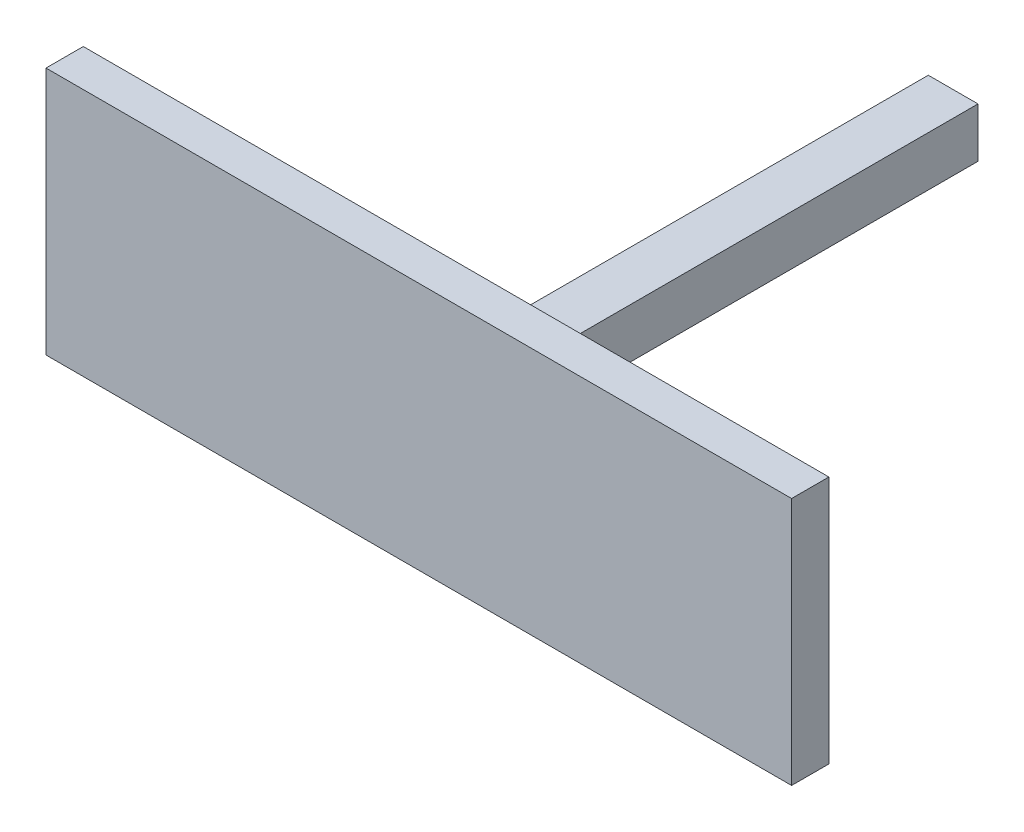
from build123d import *

# Parameters (mm, degrees)
ESQUISSE1_W        = 60
ESQUISSE1_H        = 20
BOSS_EXTRU_1_DEPTH = 3
ESQUISSE2_W        = 4
ESQUISSE2_H        = 4
BOSS_EXTRU_2_DEPTH = 40


with BuildPart() as part:
    # Esquisse1 → Boss.-Extru.1 (new body)
    with BuildSketch(Plane.XY):
        Rectangle(ESQUISSE1_W, ESQUISSE1_H)
    extrude(amount=BOSS_EXTRU_1_DEPTH)

    # Esquisse2 → Boss.-Extru.2 (add)
    with BuildSketch(Plane(origin=(0, 0, 0), x_dir=(-1, 0, 0), z_dir=(0, 0, -1))):
        Rectangle(ESQUISSE2_W, ESQUISSE2_H)
    extrude(amount=BOSS_EXTRU_2_DEPTH)


solid = part.part
